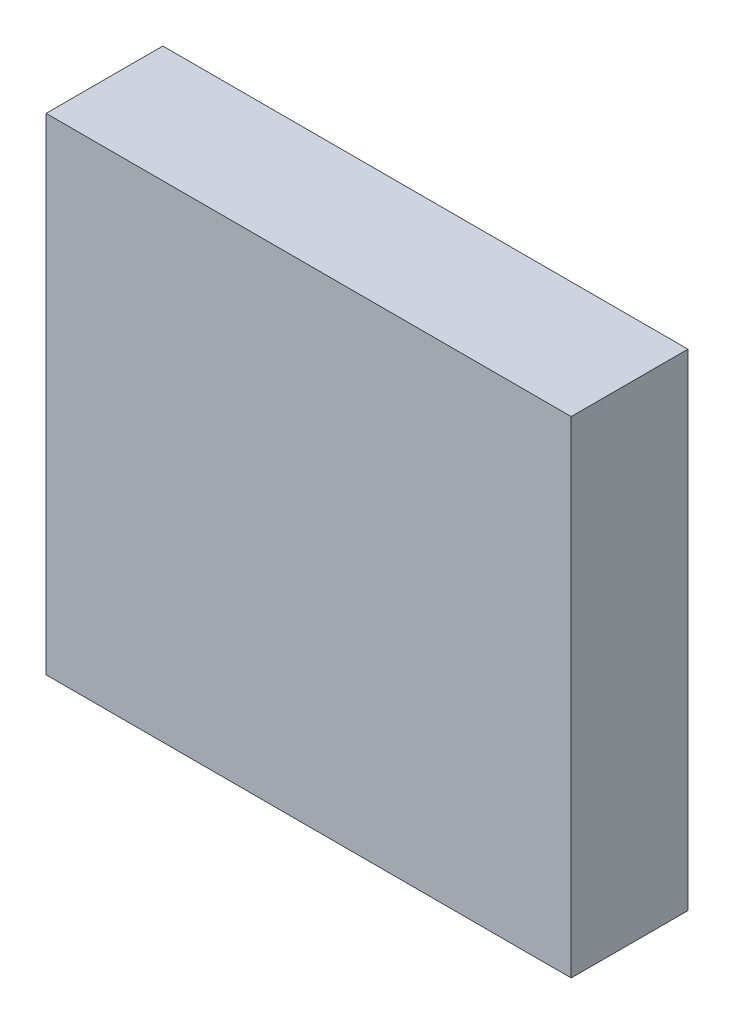
from build123d import *

# Parameters (mm, degrees)
SKETCH1_W           = 10.8
SKETCH1_H           = 10
BOSS_EXTRUDE1_DEPTH = 2.4
SKETCH2_W           = 1.2
SKETCH2_H           = 1.2
CUT_EXTRUDE1_DEPTH  = 2.8


with BuildPart() as part:
    # Sketch1 → Boss-Extrude1 (new body)
    with BuildSketch(Plane.XY):
        Rectangle(SKETCH1_W, SKETCH1_H)
    extrude(amount=BOSS_EXTRUDE1_DEPTH)

    # Sketch2 → Cut-Extrude1 (cut)
    with BuildSketch(Plane.XZ.offset(5)):
        with Locations((-1.27, 1.2)):
            Rectangle(SKETCH2_W, SKETCH2_H)
        with Locations((-3.81, 1.2)):
            Rectangle(SKETCH2_W, SKETCH2_H)
        with Locations((1.27, 1.2)):
            Rectangle(SKETCH2_W, SKETCH2_H)
        with Locations((3.81, 1.2)):
            Rectangle(SKETCH2_W, SKETCH2_H)
    extrude(amount=-CUT_EXTRUDE1_DEPTH, mode=Mode.SUBTRACT)


solid = part.part
